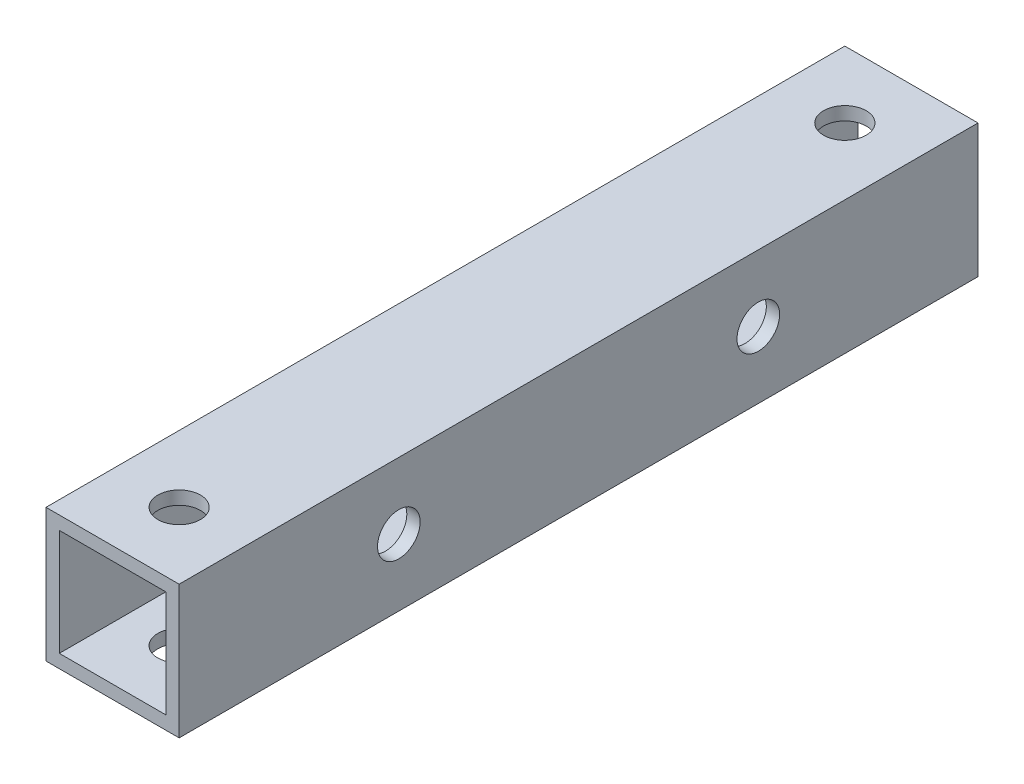
from build123d import *

# Parameters (mm, degrees)
SKETCH_1_W          = 10
SKETCH_1_H          = 10
SKETCH_1_W_2        = 8
SKETCH_1_H_2        = 8
EXTRUDE_1_DEPTH     = 30
SKETCH_2_R          = 1.6
CUT_EXTRUDE_1_DEPTH = 33.015621187
SKETCH_3_R          = 1.6
CUT_EXTRUDE_2_DEPTH = 33.015621187


with BuildPart() as part:
    # ｽｹｯﾁ1 → ﾎﾞｽ - 押し出し1 (new body)
    with BuildSketch(Plane.XY):
        Rectangle(SKETCH_1_W, SKETCH_1_H)
        Rectangle(SKETCH_1_W_2, SKETCH_1_H_2, mode=Mode.SUBTRACT)
    extrude_1 = extrude(amount=EXTRUDE_1_DEPTH)

    # ｽｹｯﾁ2 → ｶｯﾄ - 押し出し1 (cut, through all)
    with BuildSketch(Plane(origin=(5, 0, 0), x_dir=(0, 0, -1), z_dir=(1, 0, 0))):
        with Locations((-13.5, 0)):
            Circle(SKETCH_2_R)
    cut_extrude_1 = extrude(amount=-CUT_EXTRUDE_1_DEPTH, mode=Mode.SUBTRACT)

    # ｽｹｯﾁ3 → ｶｯﾄ - 押し出し2 (cut, through all)
    with BuildSketch(Plane(origin=(0, 5, 0), x_dir=(1, 0, 0), z_dir=(0, 1, 0))):
        with Locations(Location((0, -25, 0), (0, 0, 270))):
            Circle(SKETCH_3_R)
    cut_extrude_2 = extrude(amount=-CUT_EXTRUDE_2_DEPTH, mode=Mode.SUBTRACT)

    # ﾐﾗｰ1: ﾎﾞｽ - 押し出し1, ｶｯﾄ - 押し出し1, ｶｯﾄ - 押し出し2 across plane
    add(extrude_1.mirror(Plane(origin=(0, 0, 0), x_dir=(1, 0, 0), z_dir=(0, 0, -1))))
    add(cut_extrude_1.mirror(Plane(origin=(0, 0, 0), x_dir=(1, 0, 0), z_dir=(0, 0, -1))), mode=Mode.SUBTRACT)
    add(cut_extrude_2.mirror(Plane(origin=(0, 0, 0), x_dir=(1, 0, 0), z_dir=(0, 0, -1))), mode=Mode.SUBTRACT)


solid = part.part
